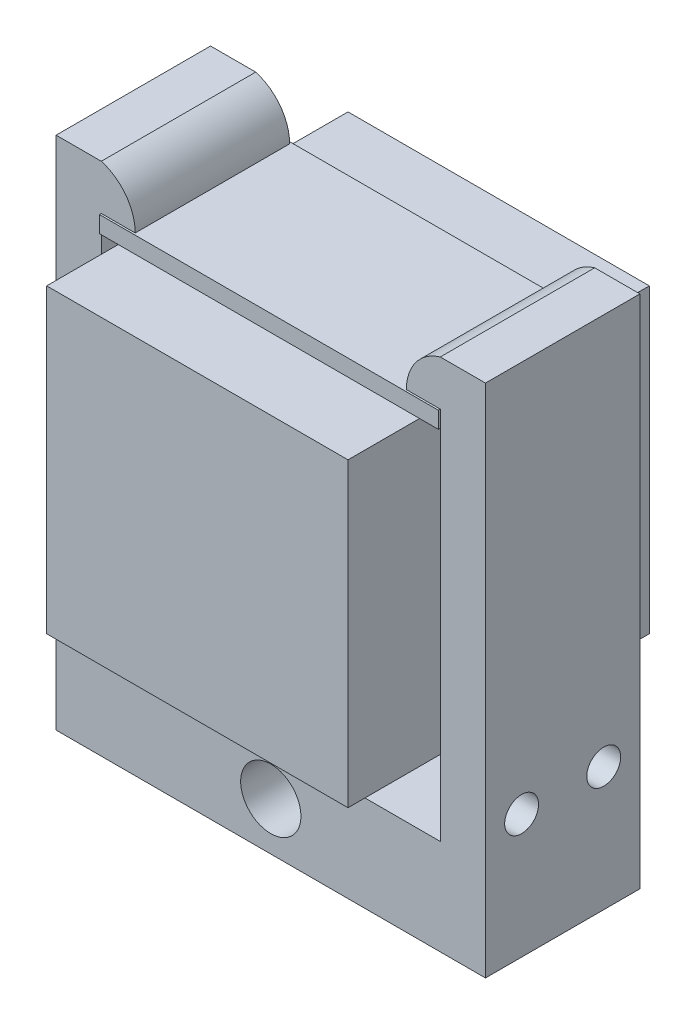
from build123d import *

# Parameters (mm, degrees)
SKETCH1_W                            = 45
SKETCH1_H                            = 21
BOSS_EXTRUDE1_DEPTH                  = 2.2
SKETCH2_W                            = 40
SKETCH2_H                            = 40
BOSS_EXTRUDE2_DEPTH                  = 40
SKETCH3_W                            = 45
SKETCH3_H                            = 12.7
SKETCH3_R                            = 4
SNAPFIT_41MM_SPACING_4MM_WIDTH_DEPTH = 10.25
SKETCH4_R                            = 2.25
CUT_EXTRUDE1_DEPTH                   = 86.282120049
BOLTCLAMPP_WIDTH_6MM_DEPTH           = 3


with BuildPart() as part:
    # Sketch1 → Boss-Extrude1 (new body)
    with BuildSketch(Plane(origin=(0, 0, 0), x_dir=(1, 0, 0), z_dir=(0, 1, 0))):
        Rectangle(SKETCH1_W, SKETCH1_H)
    extrude(amount=BOSS_EXTRUDE1_DEPTH)


with BuildPart() as body_2:
    # Sketch2 → Boss-Extrude2 (new body)
    with BuildSketch(Plane(origin=(0, 0, 0), x_dir=(1, 0, 0), z_dir=(0, 1, 0))):
        Rectangle(SKETCH2_W, SKETCH2_H)
    extrude(amount=-BOSS_EXTRUDE2_DEPTH)


with BuildPart() as body_3:
    # Sketch3 → SnapFit-41mm_spacing-4mm_width (new, symmetric)
    # profile 1 of 3: a face of its own
    with BuildSketch(Plane.XY):
        with Locations((0, -53.85)):
            Rectangle(SKETCH3_W, SKETCH3_H)
        with Locations((0, -53.85)):
            Circle(SKETCH3_R, mode=Mode.SUBTRACT)
    # profile 2 of 3: a face of its own
    with BuildSketch(Plane.XY):
        with BuildLine():
            Line((-28.5, -60.2), (-22.5, -60.2))
            Line((-22.5, -60.2), (-22.5, -47.5))
            Line((-22.5, -47.5), (-22.5, 0))
            Line((-22.5, 0), (-22.5, 2.2))
            Line((-22.5, 2.2), (-18, 2.2))
            ThreePointArc((-18, 2.2), (-19.25, 5.95), (-22.5, 8.2))
            Line((-22.5, 8.2), (-28.5, 8.2))
            Line((-28.5, 8.2), (-28.5, 0))
            Line((-28.5, 0), (-28.5, -60.2))
        make_face()
    # profile 3 of 3: a face of its own
    with BuildSketch(Plane.XY):
        with BuildLine():
            Line((22.5, -47.5), (22.5, -60.2))
            Line((22.5, -60.2), (28.5, -60.2))
            Line((28.5, -60.2), (28.5, 0))
            Line((28.5, 0), (28.5, 8.2))
            Line((28.5, 8.2), (22.5, 8.2))
            ThreePointArc((22.5, 8.2), (19.25, 5.95), (18, 2.2))
            Line((18, 2.2), (22.5, 2.2))
            Line((22.5, 2.2), (22.5, 0))
            Line((22.5, 0), (22.5, -47.5))
        make_face()
    extrude(amount=SNAPFIT_41MM_SPACING_4MM_WIDTH_DEPTH, both=True)

    # Sketch4 → Cut-Extrude1 (cut, through all)
    with BuildSketch(Plane(origin=(28.5, 0, 0), x_dir=(0, 0, -1), z_dir=(1, 0, 0))):
        with Locations((-5.45, -43.75)):
            Circle(SKETCH4_R)
        with Locations(Location((5.45, -43.75, 0), (0, 0, 180))):
            Circle(SKETCH4_R)
    extrude(amount=-CUT_EXTRUDE1_DEPTH, mode=Mode.SUBTRACT)

    # Sketch5 → BoltClampP-width_6mm (cut)
    with BuildSketch(Plane.ZY.offset(28.5)):
        Polygon((-8.766877296, -41.835), (-8.766877296, -45.665), (-5.45, -47.58), (-2.133122704, -45.665), (-2.133122704, -41.835), (-5.45, -39.92), align=None)
        Polygon((8.766877296, -45.665), (5.45, -47.58), (2.133122704, -45.665), (2.133122704, -41.835), (5.45, -39.92), (8.766877296, -41.835), align=None)
    extrude(amount=-BOLTCLAMPP_WIDTH_6MM_DEPTH, mode=Mode.SUBTRACT)


solid = Compound([part.part, body_2.part, body_3.part])
